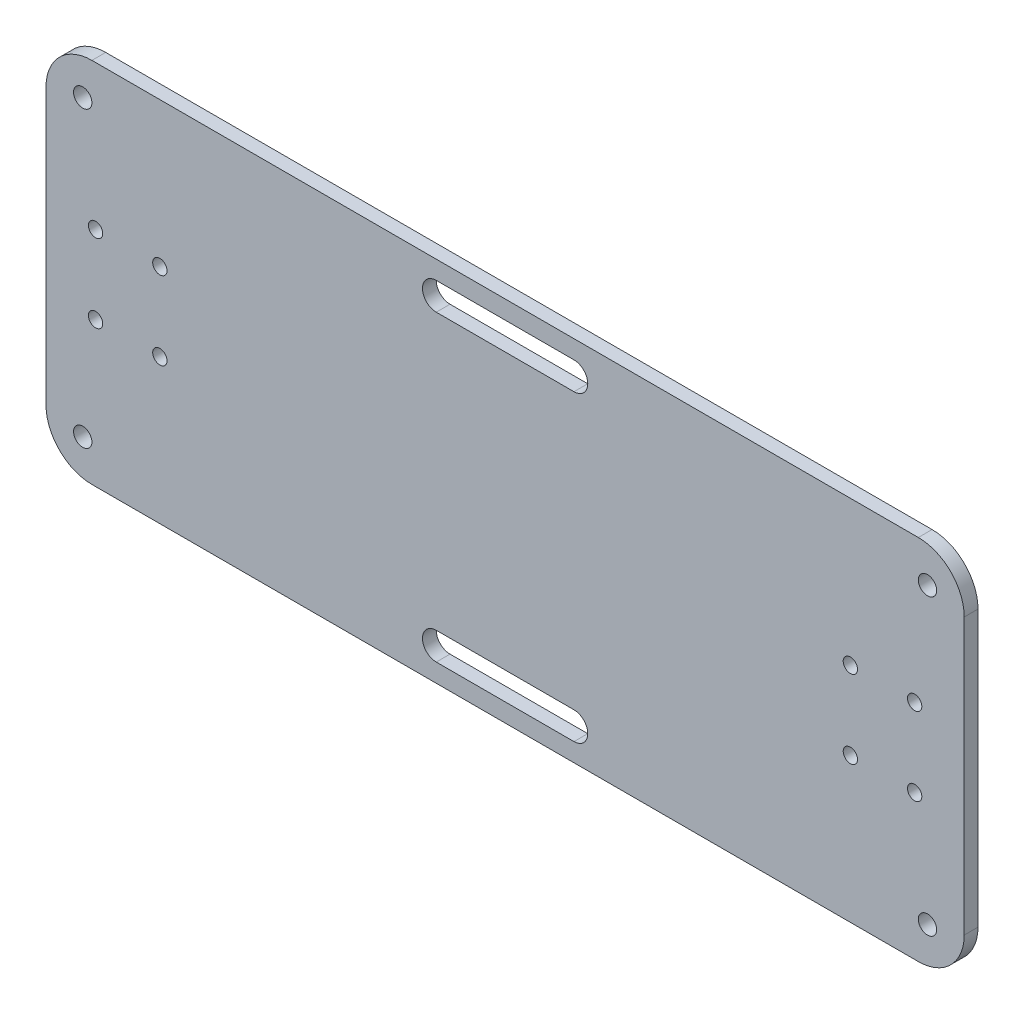
from build123d import *

# Parameters (mm, degrees)
SKETCH1_W           = 200
SKETCH1_H           = 80
BOSS_EXTRUDE1_DEPTH = 3
SKETCH2_R           = 2
CUT_EXTRUDE1_DEPTH  = 108.745069493
FILLET1_R           = 10
SKETCH3_R           = 1.560556943
CUT_EXTRUDE2_DEPTH  = 108.745069493
CUT_EXTRUDE3_DEPTH  = 108.745069493


with BuildPart() as part:
    # Sketch1 → Boss-Extrude1 (new body)
    with BuildSketch(Plane.XY):
        Rectangle(SKETCH1_W, SKETCH1_H)
    extrude(amount=BOSS_EXTRUDE1_DEPTH)

    # Sketch2 → Cut-Extrude1 (cut, through all)
    with BuildSketch(Plane.XY.offset(3)):
        with Locations((-92, 32)):
            Circle(SKETCH2_R)
        with Locations(Location((-92, -32, 0), (0, 0, 180))):
            Circle(SKETCH2_R)
        with Locations((92, -32)):
            Circle(SKETCH2_R)
        with Locations(Location((92, 32, 0), (0, 0, 180))):
            Circle(SKETCH2_R)
    extrude(amount=-CUT_EXTRUDE1_DEPTH, mode=Mode.SUBTRACT)

    # Fillet1
    fillet1_edges = [part.edges().sort_by_distance(p)[0] for p in [
        (100, -40, 1.5),
        (-100, -40, 1.5),
        (-100, 40, 1.5),
        (100, 40, 1.5),
    ]]
    fillet(fillet1_edges, radius=FILLET1_R)

    # Sketch3 → Cut-Extrude2 (cut, through all)
    with BuildSketch(Plane(origin=(0, 0, 0), x_dir=(-1, 0, 0), z_dir=(0, 0, -1))):
        with Locations((89.2, -8.5)):
            Circle(SKETCH3_R)
        with Locations((75.2, -8.5)):
            Circle(SKETCH3_R)
        with Locations((75.2, 8.5)):
            Circle(SKETCH3_R)
        with Locations((89.2, 8.5)):
            Circle(SKETCH3_R)
        with Locations((-89.2, -8.5)):
            Circle(SKETCH3_R)
        with Locations((-75.2, -8.5)):
            Circle(SKETCH3_R)
        with Locations((-89.2, 8.5)):
            Circle(SKETCH3_R)
        with Locations((-75.2, 8.5)):
            Circle(SKETCH3_R)
    extrude(amount=-CUT_EXTRUDE2_DEPTH, mode=Mode.SUBTRACT)

    # Sketch4 → Cut-Extrude3 (cut, through all)
    with BuildSketch(Plane.XY.offset(3)):
        with BuildLine():
            Line((15, 30), (-15, 30))
            ThreePointArc((-15, 30), (-18, 33), (-15, 36))
            Line((-15, 36), (15, 36))
            ThreePointArc((15, 36), (18, 33), (15, 30))
        make_face()
        with BuildLine():
            Line((15, -30), (-15, -30))
            ThreePointArc((-15, -30), (-18, -33), (-15, -36))
            Line((-15, -36), (15, -36))
            ThreePointArc((15, -36), (18, -33), (15, -30))
        make_face()
    extrude(amount=-CUT_EXTRUDE3_DEPTH, mode=Mode.SUBTRACT)


solid = part.part
